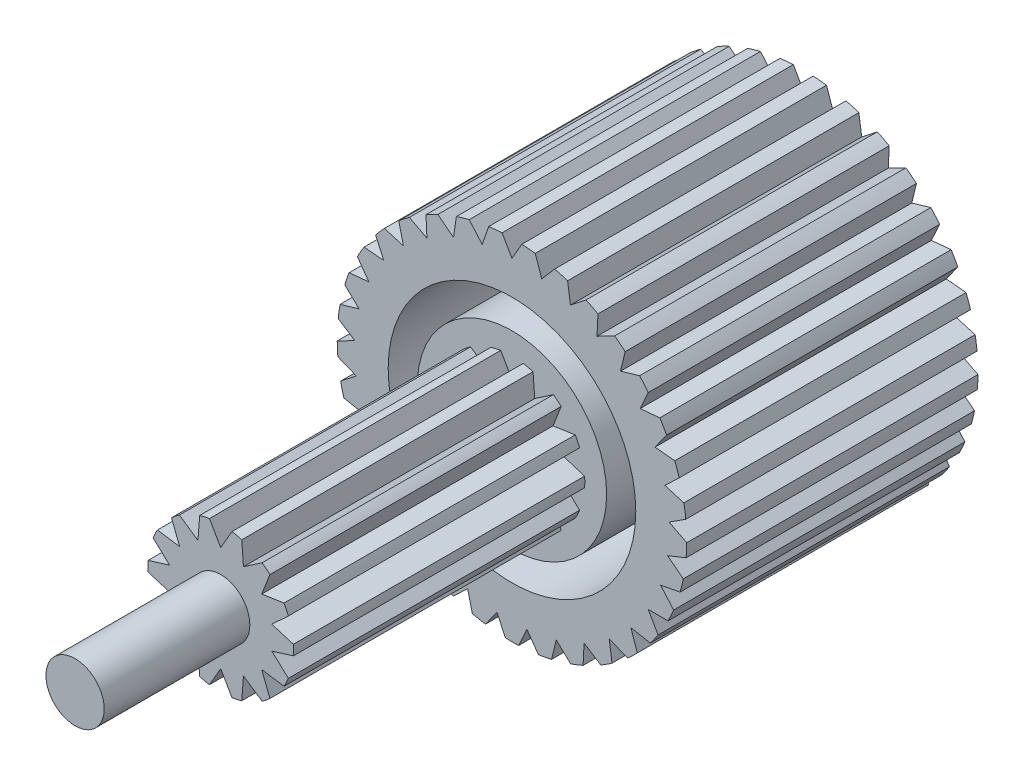
from build123d import *

# Parameters (mm, degrees)
SKETCH1_R           = 15.24
BOSS_EXTRUDE1_DEPTH = 25.4
CUT_EXTRUDE1_DEPTH  = 25.4
SKETCH3_R           = 6.35
BOSS_EXTRUDE2_DEPTH = 25.4
CUT_EXTRUDE2_DEPTH  = 25.4
SKETCH6_R           = 10.795
SKETCH6_R_2         = 8.255
CUT_EXTRUDE3_DEPTH  = 10.16
CUT_EXTRUDE4_START  = -10.16
SKETCH7_R           = 10.795
SKETCH7_R_2         = 8.255
CUT_EXTRUDE4_DEPTH  = 10.16
SKETCH8_R           = 2.54
BOSS_EXTRUDE3_DEPTH = 12.7
BOSS_EXTRUDE4_START = 3.81
SKETCH9_R           = 2.54
BOSS_EXTRUDE4_DEPTH = 3.81


with BuildPart() as part:
    # Sketch1 → Boss-Extrude1 (new body)
    with BuildSketch(Plane.XY):
        Circle(SKETCH1_R)
    extrude(amount=BOSS_EXTRUDE1_DEPTH)

    # Sketch2 → Cut-Extrude1 (cut)
    with BuildSketch(Plane.XY.offset(25.4)):
        Polygon((2.595770068, 13.468134012), (4.324370212, 15.463044922), (1.732426613, 15.962601105), align=None)
        Polygon((0, 13.716), (1.319822715, 16.002), (-1.319822715, 16.002), align=None)
        Polygon((5.097722242, 12.733494569), (7.172623702, 14.365215113), (4.722061529, 15.346272216), align=None)
        Polygon((7.415429452, 11.538633456), (9.761639883, 12.748189001), (7.541028839, 14.175289064), align=None)
        Polygon((9.465123721, 9.926736067), (11.997844965, 10.670410123), (10.087443718, 12.491974033), align=None)
        Polygon((11.172723758, 7.956060572), (13.80041667, 8.206974822), (12.269272099, 10.357166512), align=None)
        Polygon((12.476512448, 5.697832318), (15.10420536, 5.446918068), (14.007657019, 7.848024008), align=None)
        Polygon((13.329367471, 3.233669559), (15.862088715, 2.489995503), (15.239768718, 5.055233469), align=None)
        Polygon((13.700464424, 0.652633557), (16.046674855, -0.556921987), (15.921075468, 2.079733621), align=None)
        Polygon((13.576390897, -1.951990322), (15.651292357, -3.583710865), (16.026953069, -0.970933219), align=None)
        Polygon((12.961631229, -4.486064185), (14.690231374, -6.480975096), (15.553574829, -3.986508002), align=None)
        Polygon((11.878404438, -6.858), (13.198227154, -9.144), (14.518049869, -6.858), align=None)
        Polygon((10.365861162, -8.982069827), (11.229204617, -11.47653692), (12.957804761, -9.481626009), align=None)
        Polygon((8.478668655, -10.781504247), (8.854329368, -13.394281894), (10.929230827, -11.76256135), align=None)
        Polygon((6.285034972, -12.191267014), (6.159435585, -14.827922622), (8.505646016, -13.618367077), align=None)
        Polygon((3.86424375, -13.160405626), (3.241923753, -15.725643592), (5.774644996, -14.981969536), align=None)
        Polygon((1.30378869, -13.65389289), (0.207240349, -16.05499883), (2.834933261, -15.80408458), align=None)
        Polygon((-1.30378869, -13.65389289), (-2.834933261, -15.80408458), (-0.207240349, -16.05499883), align=None)
        Polygon((-3.86424375, -13.160405626), (-5.774644996, -14.981969536), (-3.241923753, -15.725643592), align=None)
        Polygon((-6.285034972, -12.191267014), (-8.505646016, -13.618367077), (-6.159435585, -14.827922622), align=None)
        Polygon((-8.478668655, -10.781504247), (-10.929230827, -11.76256135), (-8.854329368, -13.394281894), align=None)
        Polygon((-10.365861162, -8.982069827), (-12.957804761, -9.481626009), (-11.229204617, -11.47653692), align=None)
        Polygon((-11.878404438, -6.858), (-14.518049869, -6.858), (-13.198227154, -9.144), align=None)
        Polygon((-12.961631229, -4.486064185), (-15.553574829, -3.986508002), (-14.690231374, -6.480975096), align=None)
        Polygon((-13.576390897, -1.951990322), (-16.026953069, -0.970933219), (-15.651292357, -3.583710865), align=None)
        Polygon((-13.700464424, 0.652633557), (-15.921075468, 2.079733621), (-16.046674855, -0.556921987), align=None)
        Polygon((-13.329367471, 3.233669559), (-15.239768718, 5.055233469), (-15.862088715, 2.489995503), align=None)
        Polygon((-12.476512448, 5.697832318), (-14.007657019, 7.848024008), (-15.10420536, 5.446918068), align=None)
        Polygon((-11.172723758, 7.956060572), (-12.269272099, 10.357166512), (-13.80041667, 8.206974822), align=None)
        Polygon((-9.465123721, 9.926736067), (-10.087443718, 12.491974033), (-11.997844965, 10.670410123), align=None)
        Polygon((-7.415429452, 11.538633456), (-7.541028839, 14.175289064), (-9.761639883, 12.748189001), align=None)
        Polygon((-5.097722242, 12.733494569), (-4.722061529, 15.346272216), (-7.172623702, 14.365215113), align=None)
        Polygon((-2.595770068, 13.468134012), (-1.732426613, 15.962601105), (-4.324370212, 15.463044922), align=None)
    extrude(amount=-CUT_EXTRUDE1_DEPTH, mode=Mode.SUBTRACT)

    # Sketch3 → Boss-Extrude2 (add)
    with BuildSketch(Plane.XY.offset(25.4)):
        Circle(SKETCH3_R)
    extrude(amount=BOSS_EXTRUDE2_DEPTH)

    # Sketch5 → Cut-Extrude2 (cut)
    with BuildSketch(Plane.XY.offset(50.8)):
        Polygon((1.983716455, 4.119229664), (4.528190095, 5.854022418), (1.75357868, 7.190204852), align=None)
        Polygon((0, 4.572), (1.539793168, 7.239), (-1.539793168, 7.239), align=None)
        Polygon((3.574533538, 2.850595374), (6.619723439, 3.3095839), (4.699632764, 5.717301451), align=None)
        Polygon((4.457370414, 1.01736571), (7.40013937, 0.109641703), (6.714866942, 3.112016379), align=None)
        Polygon((4.457370414, -1.01736571), (6.714866942, -3.112016379), (7.40013937, -0.109641703), align=None)
        Polygon((3.574533538, -2.850595374), (4.699632764, -5.717301451), (6.619723439, -3.3095839), align=None)
        Polygon((1.983716455, -4.119229664), (1.75357868, -7.190204852), (4.528190095, -5.854022418), align=None)
        Polygon((0, -4.572), (-1.539793168, -7.239), (1.539793168, -7.239), align=None)
        Polygon((-1.983716455, -4.119229664), (-4.528190095, -5.854022418), (-1.75357868, -7.190204852), align=None)
        Polygon((-3.574533538, -2.850595374), (-6.619723439, -3.3095839), (-4.699632764, -5.717301451), align=None)
        Polygon((-4.457370414, -1.01736571), (-7.40013937, -0.109641703), (-6.714866942, -3.112016379), align=None)
        Polygon((-4.457370414, 1.01736571), (-6.714866942, 3.112016379), (-7.40013937, 0.109641703), align=None)
        Polygon((-3.574533538, 2.850595374), (-4.699632764, 5.717301451), (-6.619723439, 3.3095839), align=None)
        Polygon((-1.983716455, 4.119229664), (-1.75357868, 7.190204852), (-4.528190095, 5.854022418), align=None)
    extrude(amount=-CUT_EXTRUDE2_DEPTH, mode=Mode.SUBTRACT)

    # Sketch6 → Cut-Extrude3 (cut)
    with BuildSketch(Plane.XY.offset(25.4)):
        Circle(SKETCH6_R)
        Circle(SKETCH6_R_2, mode=Mode.SUBTRACT)
    extrude(amount=-CUT_EXTRUDE3_DEPTH, mode=Mode.SUBTRACT)

    # Sketch7 → Cut-Extrude4 (cut)
    with BuildSketch(Plane(origin=(0, 0, 0), x_dir=(-1, 0, 0), z_dir=(0, 0, -1)).offset(CUT_EXTRUDE4_START)):
        with Locations(Location((0, 0, 0), (0, 0, 180))):
            Circle(SKETCH7_R)
        with Locations(Location((0, 0, 0), (0, 0, 180))):
            Circle(SKETCH7_R_2, mode=Mode.SUBTRACT)
    extrude(amount=CUT_EXTRUDE4_DEPTH, mode=Mode.SUBTRACT)

    # Sketch8 → Boss-Extrude3 (add)
    with BuildSketch(Plane.XY.offset(50.8)):
        Circle(SKETCH8_R)
    extrude(amount=BOSS_EXTRUDE3_DEPTH)

    # Sketch9 → Boss-Extrude4 (add)
    with BuildSketch(Plane(origin=(0, 0, 0), x_dir=(-1, 0, 0), z_dir=(0, 0, -1)).offset(BOSS_EXTRUDE4_START)):
        with Locations(Location((0, 0, 0), (0, 0, 180))):
            Circle(SKETCH9_R)
    extrude(amount=-BOSS_EXTRUDE4_DEPTH)


solid = part.part
